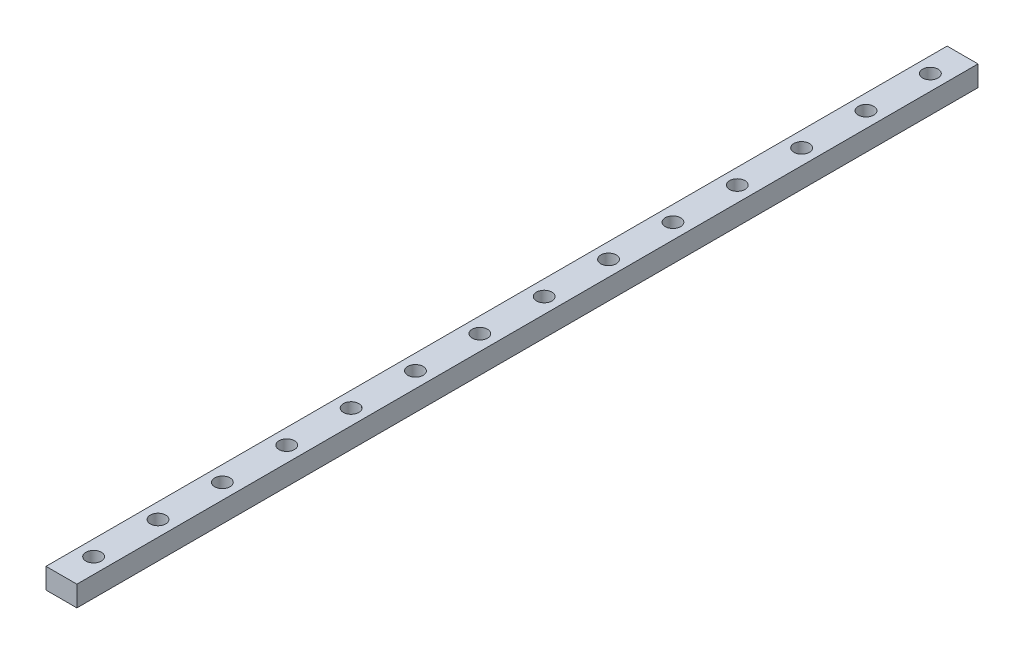
from build123d import *

# Parameters (mm, degrees)
SKETCH1_W           = 12
SKETCH1_H           = 8
BOSS_EXTRUDE1_DEPTH = 350
SKETCH2_R           = 3
CUT_EXTRUDE1_DEPTH  = 4.5
SKETCH4_R           = 1.75
CUT_EXTRUDE2_DEPTH  = 351.29701683
LPATTERN2_COUNT     = 14
LPATTERN2_PITCH     = 25


with BuildPart() as part:
    # Sketch1 → Boss-Extrude1 (new body)
    with BuildSketch(Plane.XY):
        with Locations((6, 4)):
            Rectangle(SKETCH1_W, SKETCH1_H)
    extrude(amount=BOSS_EXTRUDE1_DEPTH)

    # Sketch2 → Cut-Extrude1 (cut)
    with BuildSketch(Plane(origin=(0, 8, 0), x_dir=(1, 0, 0), z_dir=(0, 1, 0))):
        with Locations(Location((6, -12.5, 0), (0, 0, 270))):
            Circle(SKETCH2_R)
    cut_extrude1 = extrude(amount=-CUT_EXTRUDE1_DEPTH, mode=Mode.SUBTRACT)

    # Sketch4 → Cut-Extrude2 (cut, through all)
    with BuildSketch(Plane.XZ):
        with Locations(Location((6, 12.5, 0), (0, 0, 270))):
            Circle(SKETCH4_R)
    cut_extrude2 = extrude(amount=-CUT_EXTRUDE2_DEPTH, mode=Mode.SUBTRACT)

    # LPattern2: Cut-Extrude1, Cut-Extrude2 ×14
    with Locations(*[(0, 0, i * LPATTERN2_PITCH) for i in range(1, LPATTERN2_COUNT)]):
        add(cut_extrude1, mode=Mode.SUBTRACT)
        add(cut_extrude2, mode=Mode.SUBTRACT)


solid = part.part
